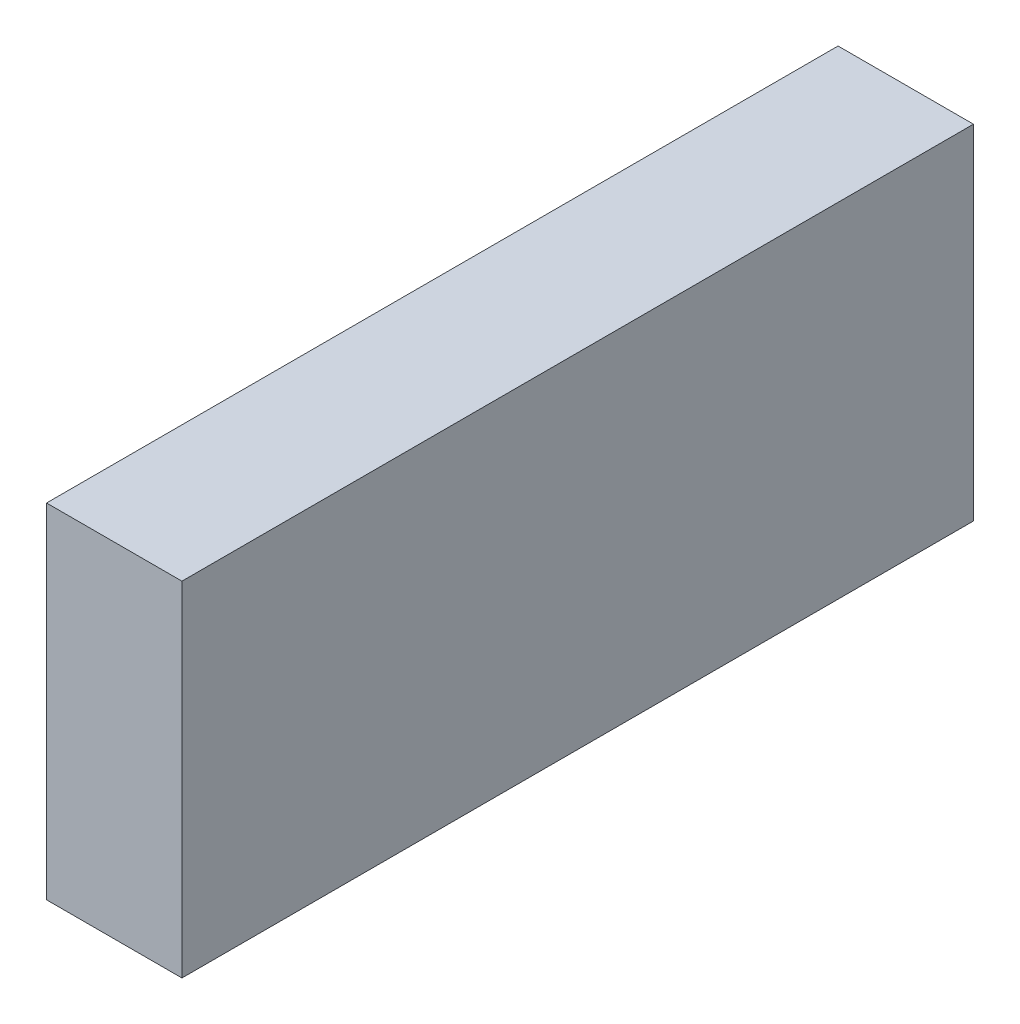
from build123d import *

# Parameters (mm, degrees)
CASE_SKETCH_W = 76
CASE_SKETCH_H = 33
CASE_2_DEPTH  = 13


with BuildPart() as part:
    # Case Sketch → Case 2 (new body)
    with BuildSketch(Plane(origin=(0, 0, 0), x_dir=(0, 0, -1), z_dir=(1, 0, 0))):
        with Locations((0, -24.5)):
            Rectangle(CASE_SKETCH_W, CASE_SKETCH_H)
    extrude(amount=-CASE_2_DEPTH)


solid = part.part
